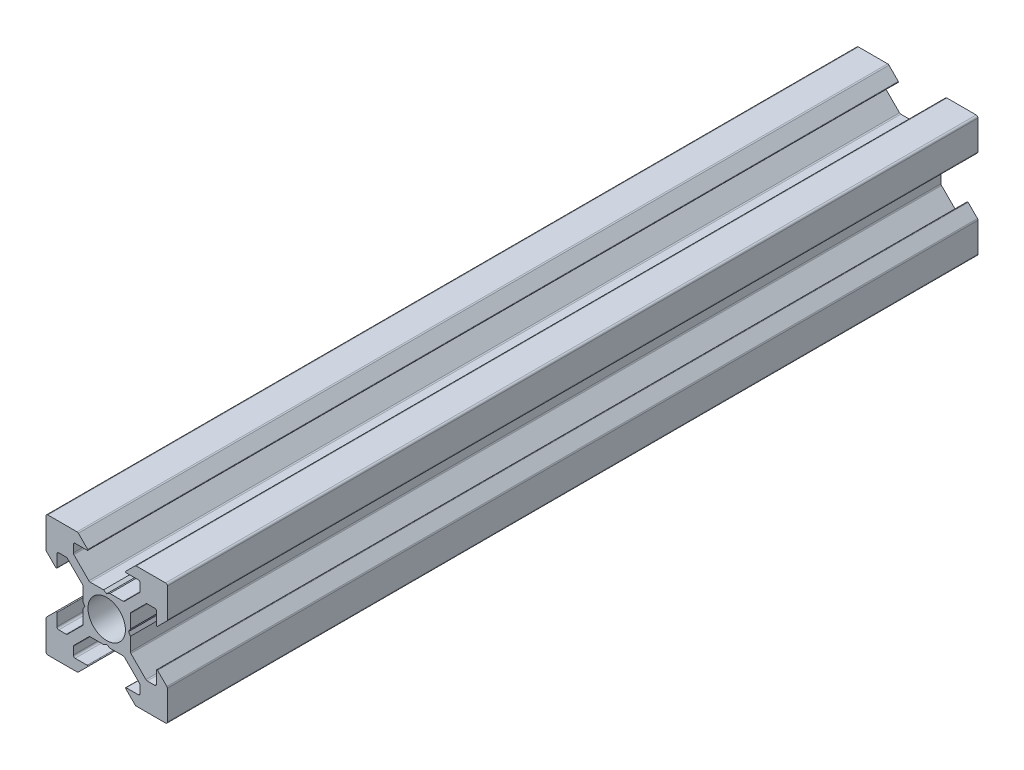
from build123d import *

# Parameters (mm, degrees)
ESQUISSE1_R        = 3
BOSS_EXTRU_1_DEPTH = 130


with BuildPart() as part:
    # Esquisse1 → Boss.-Extru.1 (new body)
    with BuildSketch(Plane.XY):
        with BuildLine():
            Line((18.273972397, -2.817988329), (18.273972397, -4.763988771))
            ThreePointArc((18.273972397, -4.763988771), (18.188448617, -4.970461441), (17.981975947, -5.055985222))
            Line((17.981975947, -5.055985222), (16.798674025, -5.055985222))
            ThreePointArc((16.798674025, -5.055985222), (16.686931822, -5.033758315), (16.592201355, -4.970461441))
            Line((16.592201355, -4.970461441), (14.174856283, -2.553116369))
            ThreePointArc((14.174856283, -2.553116369), (14.111559409, -2.458385902), (14.089332502, -2.346643699))
            Line((14.089332502, -2.346643699), (14.089332502, -0.209112213))
            Line((14.089332502, -0.209112213), (13.797336052, 0.296640474))
            Line((13.797336052, 0.296640474), (14.089332502, 0.802393162))
            Line((14.089332502, 0.802393162), (14.089332502, 2.939924647))
            ThreePointArc((14.089332502, 2.939924647), (14.111559409, 3.051666851), (14.174856283, 3.146397317))
            Line((14.174856283, 3.146397317), (16.592201355, 5.56374239))
            ThreePointArc((16.592201355, 5.56374239), (16.686931822, 5.627039264), (16.798674025, 5.64926617))
            Line((16.798674025, 5.64926617), (17.981975947, 5.64926617))
            ThreePointArc((17.981975947, 5.64926617), (18.188448617, 5.56374239), (18.273972397, 5.35726972))
            Line((18.273972397, 5.35726972), (18.273972397, 3.411269278))
            ThreePointArc((18.273972397, 3.411269278), (18.334057146, 3.321346096), (18.440128771, 3.342445054))
            Line((18.440128771, 3.342445054), (19.940427319, 4.842743602))
            ThreePointArc((19.940427319, 4.842743602), (20.003724193, 4.937474069), (20.025951099, 5.049216272))
            Line((20.025951099, 5.049216272), (20.025951099, 9.737859034))
            ThreePointArc((20.025951099, 9.737859034), (19.940427319, 9.944331704), (19.733954649, 10.029855484))
            Line((19.733954649, 10.029855484), (15.045311887, 10.029855484))
            ThreePointArc((15.045311887, 10.029855484), (14.933569683, 10.007628578), (14.838839217, 9.944331704))
            Line((14.838839217, 9.944331704), (13.338540669, 8.444033156))
            ThreePointArc((13.338540669, 8.444033156), (13.317441711, 8.337961531), (13.407364892, 8.277876782))
            Line((13.407364892, 8.277876782), (15.353365335, 8.277876782))
            ThreePointArc((15.353365335, 8.277876782), (15.559838005, 8.192353002), (15.645361785, 7.985880332))
            Line((15.645361785, 7.985880332), (15.645361785, 6.802578411))
            ThreePointArc((15.645361785, 6.802578411), (15.623134879, 6.690836207), (15.559838005, 6.596105741))
            Line((15.559838005, 6.596105741), (13.142492932, 4.178760668))
            ThreePointArc((13.142492932, 4.178760668), (13.047762466, 4.115463794), (12.936020262, 4.093236888))
            Line((12.936020262, 4.093236888), (10.798488777, 4.093236888))
            Line((10.798488777, 4.093236888), (10.292736089, 3.801240437))
            Line((10.292736089, 3.801240437), (9.786983402, 4.093236888))
            Line((9.786983402, 4.093236888), (7.649451916, 4.093236888))
            ThreePointArc((7.649451916, 4.093236888), (7.537709712, 4.115463794), (7.442979246, 4.178760668))
            Line((7.442979246, 4.178760668), (5.025634173, 6.596105741))
            ThreePointArc((5.025634173, 6.596105741), (4.962337299, 6.690836207), (4.940110393, 6.802578411))
            Line((4.940110393, 6.802578411), (4.940110393, 7.985880332))
            ThreePointArc((4.940110393, 7.985880332), (5.025634173, 8.192353002), (5.232106843, 8.277876782))
            Line((5.232106843, 8.277876782), (7.178107286, 8.277876782))
            ThreePointArc((7.178107286, 8.277876782), (7.268030467, 8.337961531), (7.246931509, 8.444033156))
            Line((7.246931509, 8.444033156), (5.746632961, 9.944331704))
            ThreePointArc((5.746632961, 9.944331704), (5.651902495, 10.007628578), (5.540160291, 10.029855484))
            Line((5.540160291, 10.029855484), (0.85151753, 10.029855484))
            ThreePointArc((0.85151753, 10.029855484), (0.64504486, 9.944331704), (0.559521079, 9.737859034))
            Line((0.559521079, 9.737859034), (0.559521079, 5.049216272))
            ThreePointArc((0.559521079, 5.049216272), (0.581747986, 4.937474069), (0.64504486, 4.842743602))
            Line((0.64504486, 4.842743602), (2.145343408, 3.342445054))
            ThreePointArc((2.145343408, 3.342445054), (2.251415032, 3.321346096), (2.311499781, 3.411269278))
            Line((2.311499781, 3.411269278), (2.311499781, 5.35726972))
            ThreePointArc((2.311499781, 5.35726972), (2.397023561, 5.56374239), (2.603496231, 5.64926617))
            Line((2.603496231, 5.64926617), (3.786798153, 5.64926617))
            ThreePointArc((3.786798153, 5.64926617), (3.898540357, 5.627039264), (3.993270823, 5.56374239))
            Line((3.993270823, 5.56374239), (6.410615896, 3.146397317))
            ThreePointArc((6.410615896, 3.146397317), (6.47391277, 3.051666851), (6.496139676, 2.939924647))
            Line((6.496139676, 2.939924647), (6.496139676, 0.802393162))
            Line((6.496139676, 0.802393162), (6.788136126, 0.296640474))
            Line((6.788136126, 0.296640474), (6.496139676, -0.209112213))
            Line((6.496139676, -0.209112213), (6.496139676, -2.346643699))
            ThreePointArc((6.496139676, -2.346643699), (6.47391277, -2.458385902), (6.410615896, -2.553116369))
            Line((6.410615896, -2.553116369), (3.993270823, -4.970461441))
            ThreePointArc((3.993270823, -4.970461441), (3.898540357, -5.033758315), (3.786798153, -5.055985222))
            Line((3.786798153, -5.055985222), (2.603496231, -5.055985222))
            ThreePointArc((2.603496231, -5.055985222), (2.397023561, -4.970461441), (2.311499781, -4.763988771))
            Line((2.311499781, -4.763988771), (2.311499781, -2.817988329))
            ThreePointArc((2.311499781, -2.817988329), (2.251415032, -2.728065147), (2.145343408, -2.749164105))
            Line((2.145343408, -2.749164105), (0.64504486, -4.249462653))
            ThreePointArc((0.64504486, -4.249462653), (0.581747986, -4.34419312), (0.559521079, -4.455935324))
            Line((0.559521079, -4.455935324), (0.559521079, -9.144578085))
            ThreePointArc((0.559521079, -9.144578085), (0.64504486, -9.351050755), (0.85151753, -9.436574535))
            Line((0.85151753, -9.436574535), (5.540160291, -9.436574535))
            ThreePointArc((5.540160291, -9.436574535), (5.651902495, -9.414347629), (5.746632961, -9.351050755))
            Line((5.746632961, -9.351050755), (7.246931509, -7.850752207))
            ThreePointArc((7.246931509, -7.850752207), (7.268030467, -7.744680582), (7.178107286, -7.684595834))
            Line((7.178107286, -7.684595834), (5.232106843, -7.684595834))
            ThreePointArc((5.232106843, -7.684595834), (5.025634173, -7.599072053), (4.940110393, -7.392599383))
            Line((4.940110393, -7.392599383), (4.940110393, -6.209297462))
            ThreePointArc((4.940110393, -6.209297462), (4.962337299, -6.097555258), (5.025634173, -6.002824792))
            Line((5.025634173, -6.002824792), (7.442979246, -3.585479719))
            ThreePointArc((7.442979246, -3.585479719), (7.537709712, -3.522182845), (7.649451916, -3.499955939))
            Line((7.649451916, -3.499955939), (9.786983402, -3.499955939))
            Line((9.786983402, -3.499955939), (10.292736089, -3.207959489))
            Line((10.292736089, -3.207959489), (10.798488777, -3.499955939))
            Line((10.798488777, -3.499955939), (12.936020262, -3.499955939))
            ThreePointArc((12.936020262, -3.499955939), (13.047762466, -3.522182845), (13.142492932, -3.585479719))
            Line((13.142492932, -3.585479719), (15.559838005, -6.002824792))
            ThreePointArc((15.559838005, -6.002824792), (15.623134879, -6.097555258), (15.645361785, -6.209297462))
            Line((15.645361785, -6.209297462), (15.645361785, -7.392599383))
            ThreePointArc((15.645361785, -7.392599383), (15.559838005, -7.599072053), (15.353365335, -7.684595834))
            Line((15.353365335, -7.684595834), (13.407364892, -7.684595834))
            ThreePointArc((13.407364892, -7.684595834), (13.317441711, -7.744680582), (13.338540669, -7.850752207))
            Line((13.338540669, -7.850752207), (14.838839217, -9.351050755))
            ThreePointArc((14.838839217, -9.351050755), (14.933569683, -9.414347629), (15.045311887, -9.436574535))
            Line((15.045311887, -9.436574535), (19.733954649, -9.436574535))
            ThreePointArc((19.733954649, -9.436574535), (19.940427319, -9.351050755), (20.025951099, -9.144578085))
            Line((20.025951099, -9.144578085), (20.025951099, -4.455935324))
            ThreePointArc((20.025951099, -4.455935324), (20.003724193, -4.34419312), (19.940427319, -4.249462653))
            Line((19.940427319, -4.249462653), (18.440128771, -2.749164105))
            ThreePointArc((18.440128771, -2.749164105), (18.334057146, -2.728065147), (18.273972397, -2.817988329))
        make_face()
        with Locations((10.292736089, 0.296640474)):
            Circle(ESQUISSE1_R, mode=Mode.SUBTRACT)
    extrude(amount=BOSS_EXTRU_1_DEPTH)


solid = part.part
